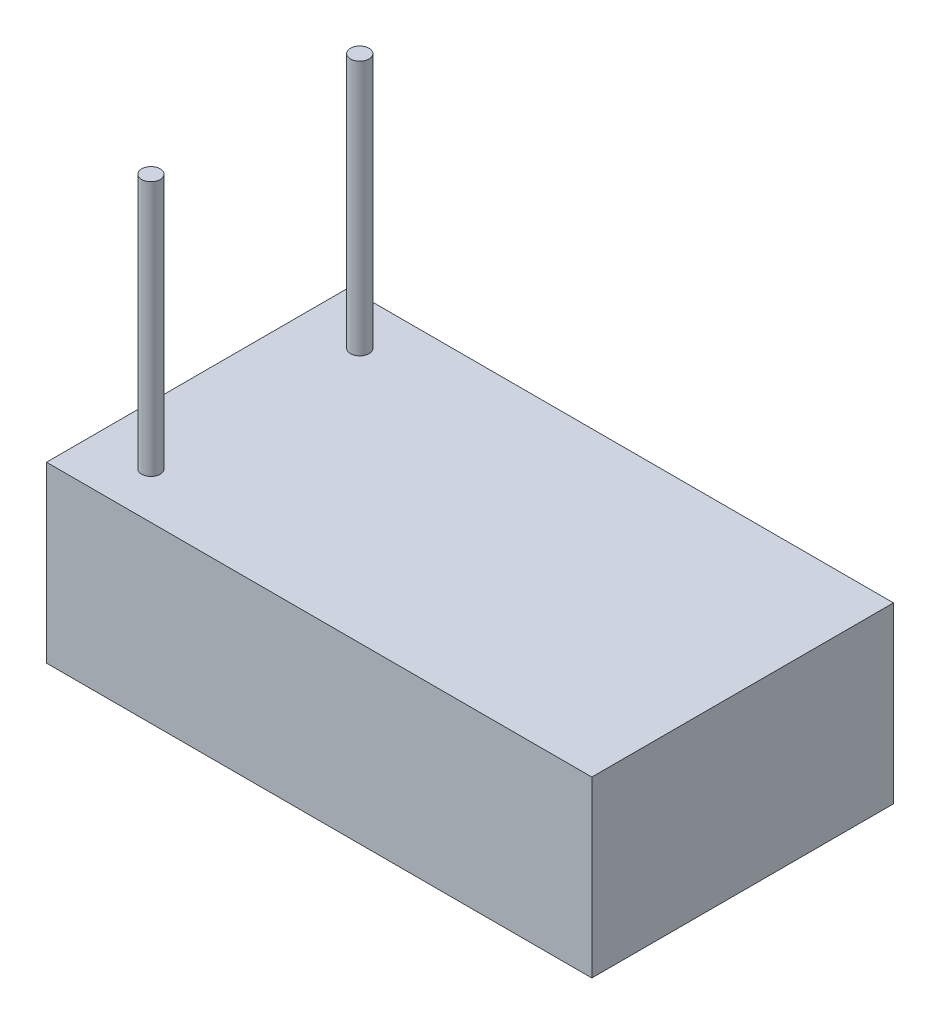
from build123d import *

# Parameters (mm, degrees)
SK_P01_RECEIVER47X26X15_W  = 47
SK_P01_RECEIVER47X26X15_H  = 26
P01_RECEIVER47X26X15_DEPTH = 15
P02_ANTENNA_START          = 15
SK_P02_ANTENNA_R           = 0.8
P02_ANTENNA_DEPTH          = 22
P03_ANTENNA_START          = 15
SK_P03_ANTENNA_R           = 0.8
P03_ANTENNA_DEPTH          = 22


with BuildPart() as part:
    # SK_P01_Receiver47x26x15 → P01_Receiver47x26x15 (new body)
    with BuildSketch(Plane(origin=(0, 0, 0), x_dir=(1, 0, 0), z_dir=(0, 1, 0))):
        Rectangle(SK_P01_RECEIVER47X26X15_W, SK_P01_RECEIVER47X26X15_H)
    extrude(amount=P01_RECEIVER47X26X15_DEPTH)

    # SK_P02_Antenna → P02_Antenna (add)
    with BuildSketch(Plane(origin=(0, 0, 0), x_dir=(1, 0, 0), z_dir=(0, 1, 0)).offset(P02_ANTENNA_START)):
        with Locations(Location((-18.5, 9, 0), (0, 0, 270))):
            Circle(SK_P02_ANTENNA_R)
    extrude(amount=P02_ANTENNA_DEPTH)

    # SK_P03_Antenna → P03_Antenna (add)
    with BuildSketch(Plane(origin=(0, 0, 0), x_dir=(1, 0, 0), z_dir=(0, 1, 0)).offset(P03_ANTENNA_START)):
        with Locations(Location((-18.5, -9, 0), (0, 0, 270))):
            Circle(SK_P03_ANTENNA_R)
    extrude(amount=P03_ANTENNA_DEPTH)


solid = part.part
